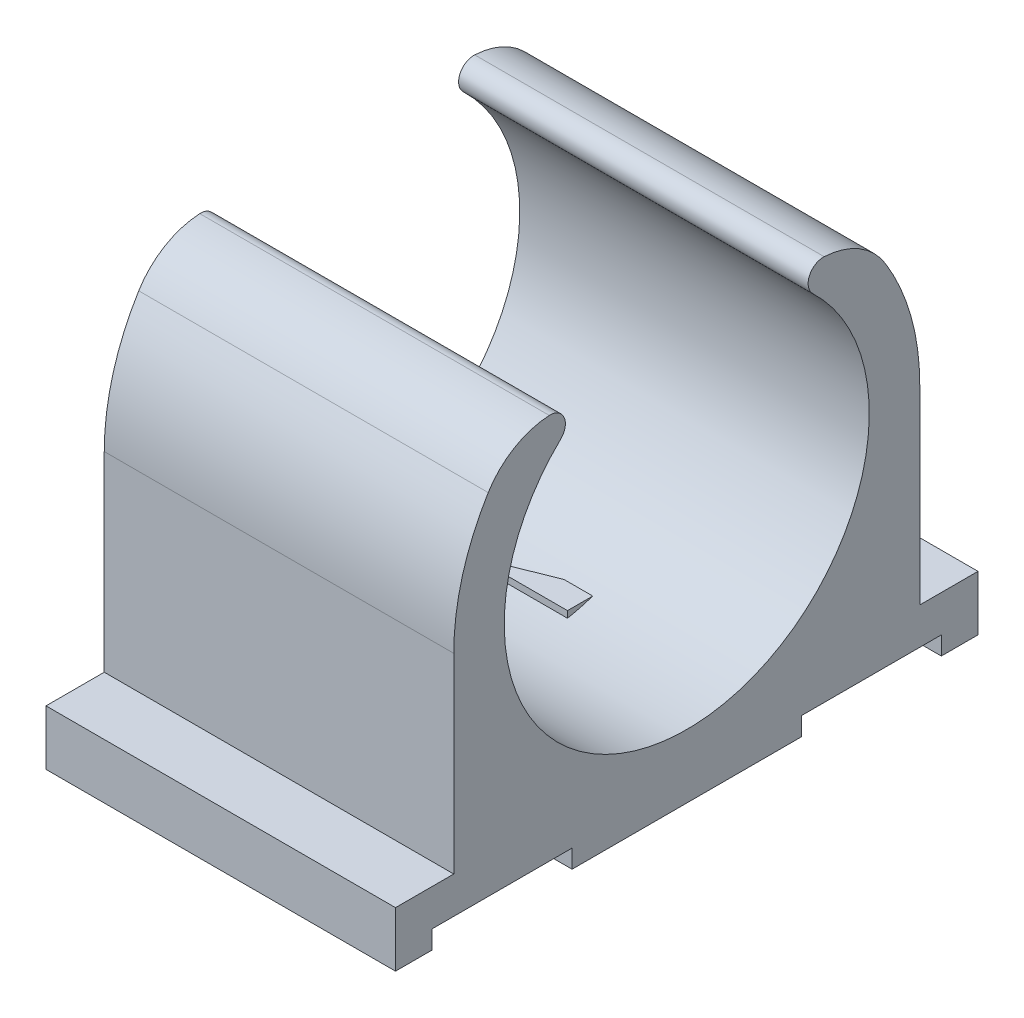
from build123d import *

# Parameters (mm, degrees)
SKETCH1_W           = 22.86
SKETCH1_H           = 38.1
BOSS_EXTRUDE1_DEPTH = 2.4
SKETCH2_W           = 22.86
SKETCH2_H           = 15
SKETCH2_H_2         = 2.4
BOSS_EXTRUDE2_DEPTH = 1.2
SKETCH3_W           = 15
SKETCH3_H           = 15
BOSS_EXTRUDE3_DEPTH = 2
SKETCH4_W           = 22.86
SKETCH4_H           = 30.48
BOSS_EXTRUDE4_DEPTH = 22.86
SKETCH5_R           = 11.938
CUT_EXTRUDE1_DEPTH  = 40.032674774
CUT_EXTRUDE2_DEPTH  = 40.032674774
FILLET1_R           = 5
FILLET2_R           = 1
BOSS_EXTRUDE5_DEPTH = 1.2


with BuildPart() as part:
    # Sketch1 → Boss-Extrude1 (new body)
    with BuildSketch(Plane(origin=(0, 0, 0), x_dir=(1, 0, 0), z_dir=(0, 1, 0))):
        Rectangle(SKETCH1_W, SKETCH1_H)
    extrude(amount=BOSS_EXTRUDE1_DEPTH)

    # Sketch2 → Boss-Extrude2 (add)
    with BuildSketch(Plane.XZ):
        Rectangle(SKETCH2_W, SKETCH2_H)
        with Locations((0, -17.85)):
            Rectangle(SKETCH2_W, SKETCH2_H_2)
        with Locations((0, 17.85)):
            Rectangle(SKETCH2_W, SKETCH2_H_2)
    extrude(amount=BOSS_EXTRUDE2_DEPTH)

    # Sketch3 → Boss-Extrude3 (add)
    with BuildSketch(Plane.XZ.offset(1.2)):
        Rectangle(SKETCH3_W, SKETCH3_H)
    extrude(amount=BOSS_EXTRUDE3_DEPTH)

    # Sketch4 → Boss-Extrude4 (add)
    with BuildSketch(Plane(origin=(0, 2.4, 0), x_dir=(1, 0, 0), z_dir=(0, 1, 0))):
        Rectangle(SKETCH4_W, SKETCH4_H)
    extrude(amount=BOSS_EXTRUDE4_DEPTH)

    # Sketch5 → Cut-Extrude1 (cut, through all)
    with BuildSketch(Plane(origin=(11.43, 0, 0), x_dir=(0, 0, -1), z_dir=(1, 0, 0))):
        with Locations((0, 14.9)):
            Circle(SKETCH5_R)
    extrude(amount=-CUT_EXTRUDE1_DEPTH, mode=Mode.SUBTRACT)

    # Sketch6 → Cut-Extrude2 (cut, through all)
    with BuildSketch(Plane(origin=(11.43, 0, 0), x_dir=(0, 0, -1), z_dir=(1, 0, 0))):
        with BuildLine():
            Line((-15.24, 25.26), (-11.177119486, 25.26))
            ThreePointArc((-11.177119486, 25.26), (-14.187968511, 20.464094672), (-15.24, 14.9))
            Line((-15.24, 14.9), (-15.24, 25.26))
        make_face()
        with BuildLine():
            Line((15.24, 14.9), (15.24, 25.26))
            Line((15.24, 25.26), (11.177119486, 25.26))
            ThreePointArc((11.177119486, 25.26), (14.187968511, 20.464094672), (15.24, 14.9))
        make_face()
    extrude(amount=-CUT_EXTRUDE2_DEPTH, mode=Mode.SUBTRACT)

    # Fillet1
    fillet1_edges = [part.edges().sort_by_distance(p)[0] for p in [
        (0, 25.26, -11.177119486),
        (0, 25.26, 11.177119486),
    ]]
    fillet(fillet1_edges, radius=FILLET1_R)

    # Fillet2
    fillet2_edges = [part.edges().sort_by_distance(p)[0] for p in [
        (0, 25.26, 5.93179939),
        (0, 25.26, -5.93179939),
    ]]
    fillet(fillet2_edges, radius=FILLET2_R)

    # Sketch7 → Boss-Extrude5 (add)
    with BuildSketch(Plane(origin=(0, 2.4, 0), x_dir=(1, 0, 0), z_dir=(0, 1, 0))):
        Polygon((-4.57, 2.2), (1.43, 2.2), (1.43, 4.6), align=None)
        Polygon((1.43, -4.6), (-4.57, -2.2), (1.43, -2.2), align=None)
    extrude(amount=BOSS_EXTRUDE5_DEPTH)


solid = part.part
